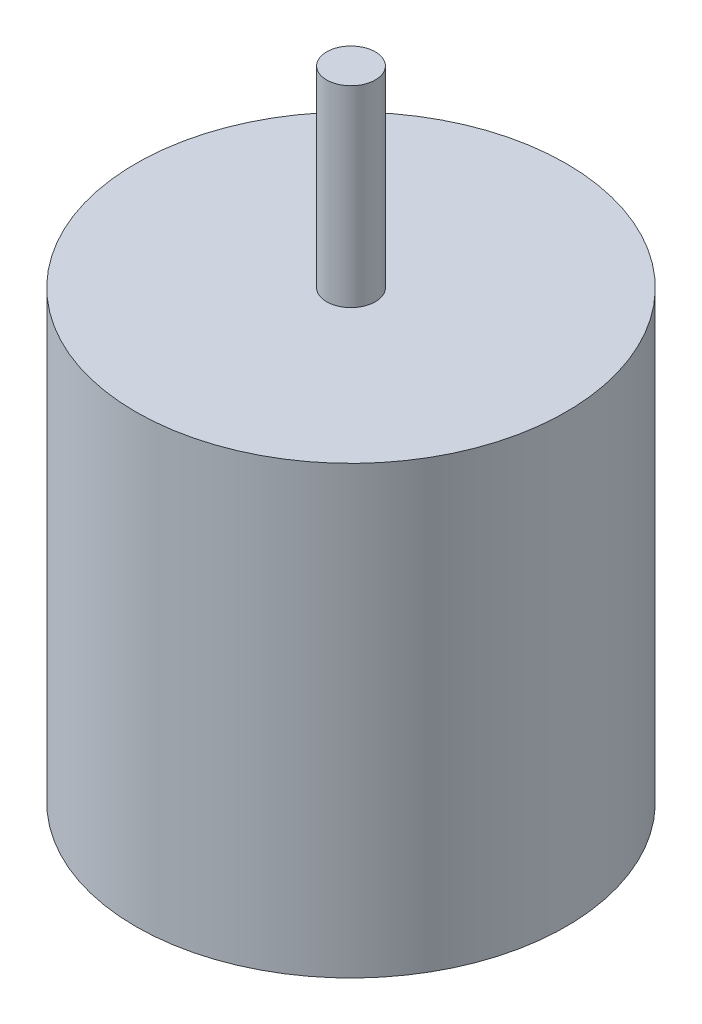
from build123d import *

# Parameters (mm, degrees)
ESQUISSE1_R        = 14
BOSS_EXTRU_1_DEPTH = 29
ESQUISSE2_R        = 1.585
BOSS_EXTRU_2_DEPTH = 12.5


with BuildPart() as part:
    # Esquisse1 → Boss.-Extru.1 (new body)
    with BuildSketch(Plane(origin=(0, 0, 0), x_dir=(1, 0, 0), z_dir=(0, 1, 0))):
        with Locations(Location((0, 0, 0), (0, 0, 90))):
            Circle(ESQUISSE1_R)
    extrude(amount=BOSS_EXTRU_1_DEPTH)

    # Esquisse2 → Boss.-Extru.2 (add)
    with BuildSketch(Plane(origin=(0, 29, 0), x_dir=(1, 0, 0), z_dir=(0, 1, 0))):
        with Locations(Location((0, 0, 0), (0, 0, 270))):
            Circle(ESQUISSE2_R)
    extrude(amount=BOSS_EXTRU_2_DEPTH)


solid = part.part
